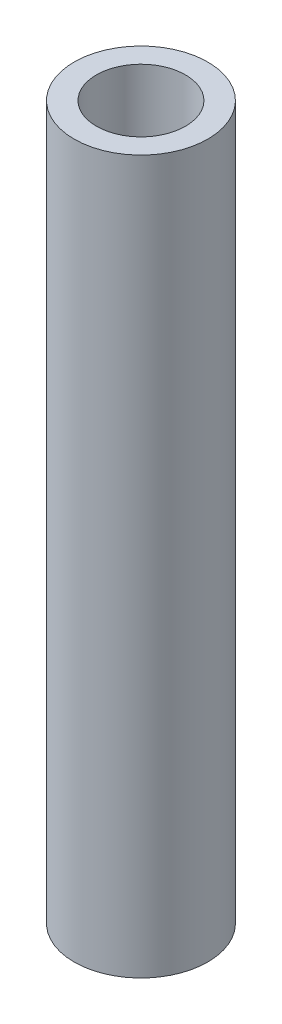
from build123d import *

# Parameters (mm, degrees)
SKETCH1_R           = 9.525
SKETCH1_R_2         = 6.35
BOSS_EXTRUDE1_DEPTH = 101.6


with BuildPart() as part:
    # Sketch1 → Boss-Extrude1 (new body)
    with BuildSketch(Plane(origin=(0, 0, 0), x_dir=(1, 0, 0), z_dir=(0, 1, 0))):
        with Locations(Location((0, 0, 0), (0, 0, 270))):
            Circle(SKETCH1_R)
        with Locations(Location((0, 0, 0), (0, 0, 270))):
            Circle(SKETCH1_R_2, mode=Mode.SUBTRACT)
    extrude(amount=BOSS_EXTRUDE1_DEPTH)


solid = part.part
